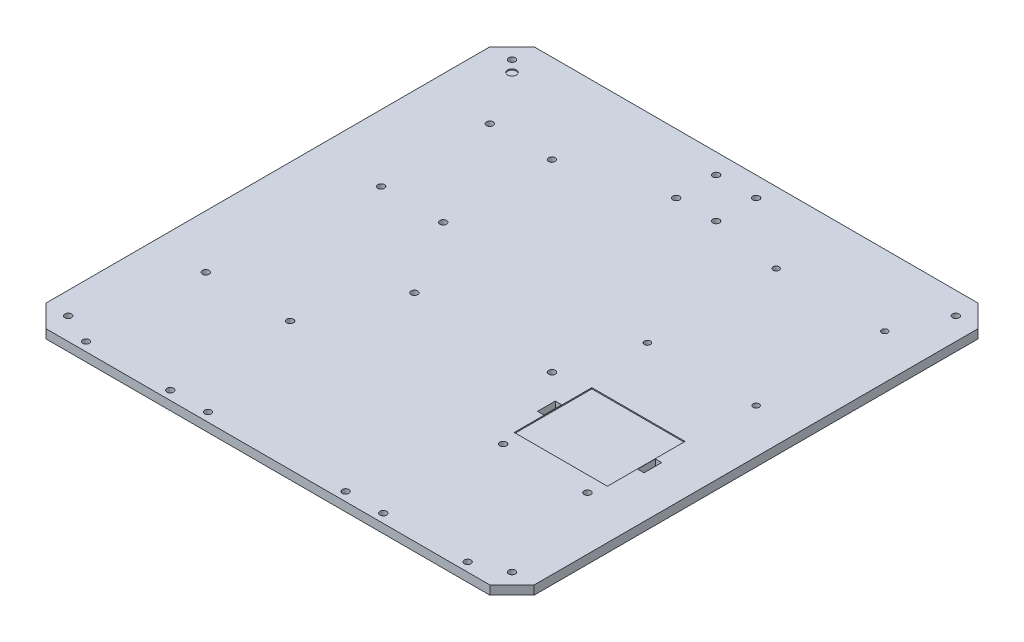
from build123d import *

# Parameters (mm, degrees)
SKETCH1_W           = 220
SKETCH1_H           = 220
BOSS_EXTRUDE1_DEPTH = 4
SKETCH2_R           = 1.5
CUT_EXTRUDE1_DEPTH  = 8
SKETCH3_R           = 1.5
CUT_EXTRUDE2_DEPTH  = 8
CHAMFER1_SIZE       = 10
SKETCH4_R           = 1.375
CUT_EXTRUDE3_DEPTH  = 4
SKETCH5_R           = 2
CUT_EXTRUDE4_DEPTH  = 0.5
SKETCH6_W           = 42
SKETCH6_H           = 35
CUT_EXTRUDE5_DEPTH  = 0.5
SKETCH7_W           = 2.9
SKETCH7_H           = 8
CUT_EXTRUDE6_DEPTH  = 312.152695634
SKETCH9_R           = 1.5
CUT_EXTRUDE7_DEPTH  = 8
SKETCH10_R          = 1.5
CUT_EXTRUDE8_DEPTH  = 312.152695634
CUT_EXTRUDE9_DEPTH  = 46
SKETCH12_R          = 1.5
CUT_EXTRUDE11_DEPTH = 312.152695634


with BuildPart() as part:
    # Sketch1 → Boss-Extrude1 (new body)
    with BuildSketch(Plane(origin=(0, 0, 0), x_dir=(1, 0, 0), z_dir=(0, 1, 0))):
        with Locations((110, 110)):
            Rectangle(SKETCH1_W, SKETCH1_H)
    extrude(amount=BOSS_EXTRUDE1_DEPTH)

    # Sketch2 → Cut-Extrude1 (cut)
    with BuildSketch(Plane(origin=(0, 4, 0), x_dir=(1, 0, 0), z_dir=(0, 1, 0))):
        with Locations(Location((196, 4, 0), (0, 0, 270))):
            Circle(SKETCH2_R)
        with Locations(Location((158, 4, 0), (0, 0, 270))):
            Circle(SKETCH2_R)
        with Locations(Location((196, 58, 0), (0, 0, 270))):
            Circle(SKETCH2_R)
        with Locations(Location((158, 58, 0), (0, 0, 270))):
            Circle(SKETCH2_R)
    extrude(amount=-CUT_EXTRUDE1_DEPTH, mode=Mode.SUBTRACT)

    # Sketch3 → Cut-Extrude2 (cut)
    with BuildSketch(Plane(origin=(0, 4, 0), x_dir=(1, 0, 0), z_dir=(0, 1, 0))):
        with Locations(Location((62, 4, 0), (0, 0, 270))):
            Circle(SKETCH3_R)
        with Locations(Location((24, 4, 0), (0, 0, 270))):
            Circle(SKETCH3_R)
        with Locations(Location((62, 58, 0), (0, 0, 270))):
            Circle(SKETCH3_R)
        with Locations(Location((24, 58, 0), (0, 0, 270))):
            Circle(SKETCH3_R)
    extrude(amount=-CUT_EXTRUDE2_DEPTH, mode=Mode.SUBTRACT)

    # Chamfer1
    chamfer1_edges = [part.edges().sort_by_distance(p)[0] for p in [
        (0, 2, -220),
        (220, 2, -220),
        (220, 2, 0),
        (0, 2, 0),
    ]]
    chamfer(chamfer1_edges, length=CHAMFER1_SIZE)

    # Sketch4 → Cut-Extrude3 (cut)
    with BuildSketch(Plane(origin=(0, 4, 0), x_dir=(1, 0, 0), z_dir=(0, 1, 0))):
        with Locations(Location((151, 130, 0), (0, 0, 270))):
            Circle(SKETCH4_R)
        with Locations(Location((200, 130, 0), (0, 0, 270))):
            Circle(SKETCH4_R)
        with Locations(Location((151, 188, 0), (0, 0, 270))):
            Circle(SKETCH4_R)
        with Locations(Location((200, 188, 0), (0, 0, 270))):
            Circle(SKETCH4_R)
    extrude(amount=-CUT_EXTRUDE3_DEPTH, mode=Mode.SUBTRACT)

    # Sketch5 → Cut-Extrude4 (cut)
    with BuildSketch(Plane(origin=(0, 4, 0), x_dir=(1, 0, 0), z_dir=(0, 1, 0))):
        with Locations(Location((15, 205, 0), (0, 0, 270))):
            Circle(SKETCH5_R)
    extrude(amount=-CUT_EXTRUDE4_DEPTH, mode=Mode.SUBTRACT)

    # Sketch6 → Cut-Extrude5 (cut)
    with BuildSketch(Plane(origin=(0, 4, 0), x_dir=(1, 0, 0), z_dir=(0, 1, 0))):
        with Locations((177, 82.5)):
            Rectangle(SKETCH6_W, SKETCH6_H)
    extrude(amount=-CUT_EXTRUDE5_DEPTH, mode=Mode.SUBTRACT)

    # Sketch7 → Cut-Extrude6 (cut, through all)
    with BuildSketch(Plane(origin=(0, 4, 0), x_dir=(1, 0, 0), z_dir=(0, 1, 0))):
        with Locations((199.55, 82.5)):
            Rectangle(SKETCH7_W, SKETCH7_H)
        with Locations((154.45, 82.5)):
            Rectangle(SKETCH7_W, SKETCH7_H)
    extrude(amount=-CUT_EXTRUDE6_DEPTH, mode=Mode.SUBTRACT)

    # Sketch9 → Cut-Extrude7 (cut)
    with BuildSketch(Plane(origin=(0, 4, 0), x_dir=(1, 0, 0), z_dir=(0, 1, 0))):
        with Locations(Location((30, 180, 0), (0, 0, 270))):
            Circle(SKETCH9_R)
        with Locations(Location((58, 180, 0), (0, 0, 270))):
            Circle(SKETCH9_R)
        with Locations(Location((58, 131, 0), (0, 0, 270))):
            Circle(SKETCH9_R)
        with Locations(Location((30, 131, 0), (0, 0, 270))):
            Circle(SKETCH9_R)
    extrude(amount=-CUT_EXTRUDE7_DEPTH, mode=Mode.SUBTRACT)

    # Sketch10 → Cut-Extrude8 (cut, through all)
    with BuildSketch(Plane(origin=(0, 4, 0), x_dir=(1, 0, 0), z_dir=(0, 1, 0))):
        with Locations(Location((10, 210, 0), (0, 0, 270))):
            Circle(SKETCH10_R)
        with Locations(Location((10, 10, 0), (0, 0, 270))):
            Circle(SKETCH10_R)
        with Locations(Location((210, 10, 0), (0, 0, 270))):
            Circle(SKETCH10_R)
        with Locations(Location((210, 210, 0), (0, 0, 270))):
            Circle(SKETCH10_R)
    extrude(amount=-CUT_EXTRUDE8_DEPTH, mode=Mode.SUBTRACT)

    # Sketch11 → Cut-Extrude9 (cut)
    with BuildSketch(Plane(origin=(0, 4, 0), x_dir=(1, 0, 0), z_dir=(0, 1, 0))):
        with BuildLine():
            ThreePointArc((119, 194.501197137), (117.939339828, 194.061857309), (117.5, 193.001197137))
            Line((117.5, 193.001197137), (119, 193.001197137))
            Line((119, 193.001197137), (119, 194.501197137))
        make_face()
        with BuildLine():
            Line((119, 193.001197137), (117.5, 193.001197137))
            ThreePointArc((117.5, 193.001197137), (119, 191.501197137), (120.5, 193.001197137))
            ThreePointArc((120.5, 193.001197137), (120.060660172, 194.061857309), (119, 194.501197137))
            Line((119, 194.501197137), (119, 193.001197137))
        make_face()
        with BuildLine():
            ThreePointArc((101, 194.501197137), (99.939339828, 191.940536965), (102.5, 193.001197137))
            Line((102.5, 193.001197137), (101, 193.001197137))
            Line((101, 193.001197137), (101, 194.501197137))
        make_face()
        with BuildLine():
            Line((101, 193.001197137), (102.5, 193.001197137))
            ThreePointArc((102.5, 193.001197137), (102.060660172, 194.061857309), (101, 194.501197137))
            Line((101, 194.501197137), (101, 193.001197137))
        make_face()
        with BuildLine():
            ThreePointArc((102.5, 211.001197137), (99.939339828, 212.061857309), (101, 209.501197137))
            Line((101, 209.501197137), (101, 211.001197137))
            Line((101, 211.001197137), (102.5, 211.001197137))
        make_face()
        with BuildLine():
            Line((101, 211.001197137), (101, 209.501197137))
            ThreePointArc((101, 209.501197137), (102.060660172, 209.940536965), (102.5, 211.001197137))
            Line((102.5, 211.001197137), (101, 211.001197137))
        make_face()
        with BuildLine():
            ThreePointArc((117.5, 211.001197137), (117.939339828, 209.940536965), (119, 209.501197137))
            Line((119, 209.501197137), (119, 211.001197137))
            Line((119, 211.001197137), (117.5, 211.001197137))
        make_face()
        with BuildLine():
            Line((119, 211.001197137), (119, 209.501197137))
            ThreePointArc((119, 209.501197137), (120.060660172, 209.940536965), (120.5, 211.001197137))
            ThreePointArc((120.5, 211.001197137), (119, 212.501197137), (117.5, 211.001197137))
            Line((117.5, 211.001197137), (119, 211.001197137))
        make_face()
    extrude(amount=-CUT_EXTRUDE9_DEPTH, mode=Mode.SUBTRACT)

    # Sketch12 → Cut-Extrude11 (cut, through all)
    with BuildSketch(Plane(origin=(0, 4, 0), x_dir=(1, 0, 0), z_dir=(0, 1, 0))):
        with Locations(Location((141, 4, 0), (0, 0, 270))):
            Circle(SKETCH12_R)
        with Locations(Location((79, 4, 0), (0, 0, 270))):
            Circle(SKETCH12_R)
        with Locations(Location((141, 97, 0), (0, 0, 270))):
            Circle(SKETCH12_R)
        with Locations(Location((79, 97, 0), (0, 0, 270))):
            Circle(SKETCH12_R)
    extrude(amount=-CUT_EXTRUDE11_DEPTH, mode=Mode.SUBTRACT)


solid = part.part
